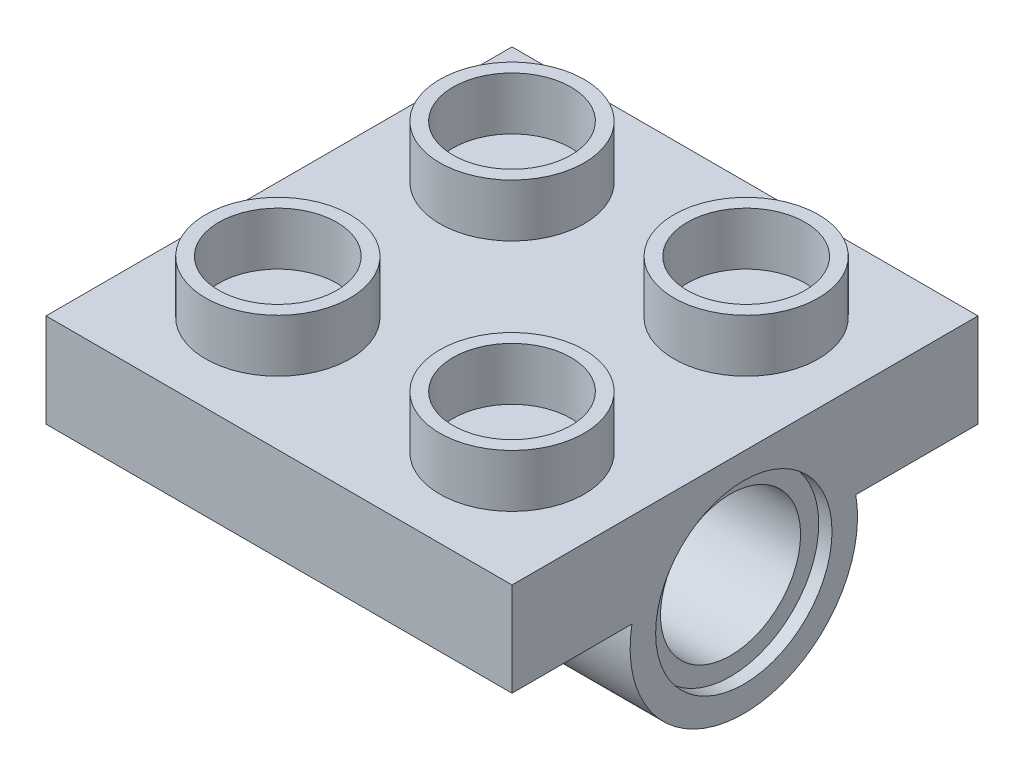
from build123d import *

# Parameters (mm, degrees)
SKETCH1_W               = 15.8
SKETCH1_H               = 15.8
BOSS_EXTRUDE1_DEPTH     = 7.71
SKETCH2_R               = 2.99
CUT_EXTRUDE1_DEPTH      = 0.45
SKETCH3_R               = 2.375
CUT_EXTRUDE2_DEPTH      = 6.56
CUT_EXTRUDE4_DEPTH      = 20.274182214
CUT_EXTRUDE4_DEPTH_BACK = 20.274182214
CUT_EXTRUDE5_DEPTH      = 20.274182214
CUT_EXTRUDE5_DEPTH_BACK = 8.87
CUT_EXTRUDE6_DEPTH      = 2.07
SKETCH10_W              = 5.44
SKETCH10_H              = 0.215050188
CUT_EXTRUDE8_DEPTH      = 2.07
SKETCH11_W              = 5.44
SKETCH11_H              = 0.461737218
CUT_EXTRUDE9_DEPTH      = 2.07
SKETCH12_W              = 4.93
SKETCH12_H              = 12.94
CUT_EXTRUDE10_DEPTH     = 2.07
SKETCH13_R              = 1.425
SKETCH13_R_2            = 1.1
BOSS_EXTRUDE2_DEPTH     = 1.87
SKETCH14_R              = 2.45
SKETCH14_R_2            = 2
BOSS_EXTRUDE3_DEPTH     = 1.79


with BuildPart() as part:
    # Sketch1 → Boss-Extrude1 (new body)
    with BuildSketch(Plane(origin=(0, 0, 0), x_dir=(1, 0, 0), z_dir=(0, 1, 0))):
        Rectangle(SKETCH1_W, SKETCH1_H)
    extrude(amount=-BOSS_EXTRUDE1_DEPTH)

    # Sketch2 → Cut-Extrude1 (cut)
    with BuildSketch(Plane(origin=(7.9, 0, 0), x_dir=(0, 0, -1), z_dir=(1, 0, 0))):
        with Locations((-0.04, -3.855)):
            Circle(SKETCH2_R)
    extrude(amount=-CUT_EXTRUDE1_DEPTH, mode=Mode.SUBTRACT)

    # Sketch3 → Cut-Extrude2 (cut)
    with BuildSketch(Plane(origin=(7.45, 0, 0), x_dir=(0, 0, -1), z_dir=(1, 0, 0))):
        with Locations((-0.04, -3.855)):
            Circle(SKETCH3_R)
    extrude(amount=-CUT_EXTRUDE2_DEPTH, mode=Mode.SUBTRACT)

    # Sketch4 → Cut-Extrude4 (cut, two sides: drawn at the far end of the back side and taken through both)
    with BuildSketch(Plane(origin=(7.9, 0, 0), x_dir=(0, 0, -1), z_dir=(1, 0, 0)).offset(-CUT_EXTRUDE4_DEPTH_BACK)):
        with BuildLine():
            Line((-50.773144054, -3.18), (-7.9, -3.18))
            Line((-7.9, -3.18), (-3.835444638, -3.18))
            ThreePointArc((-3.835444638, -3.18), (-0.04, -7.71), (3.755444638, -3.18))
            Line((3.755444638, -3.18), (7.9, -3.18))
            Line((7.9, -3.18), (50.773144054, -3.18))
            Line((50.773144054, -3.18), (50.773144054, -88.926288108))
            Line((50.773144054, -88.926288108), (-50.773144054, -88.926288108))
            Line((-50.773144054, -88.926288108), (-50.773144054, -3.18))
        make_face()
    extrude(amount=CUT_EXTRUDE4_DEPTH + CUT_EXTRUDE4_DEPTH_BACK, mode=Mode.SUBTRACT)

    # Sketch6 → Cut-Extrude5 (cut, two sides: drawn at the far end of the back side and taken through both)
    with BuildSketch(Plane.ZY.offset(7.9).offset(-CUT_EXTRUDE5_DEPTH_BACK)):
        Polygon((-38.914265028, -3.18), (-3.755444638, -3.18), (3.835444638, -3.18), (38.994265028, -3.18), (38.994265028, -73.49764078), (-38.914265028, -73.49764078), align=None)
    extrude(amount=CUT_EXTRUDE5_DEPTH + CUT_EXTRUDE5_DEPTH_BACK, mode=Mode.SUBTRACT)

    # Sketch7 → Cut-Extrude6 (cut)
    with BuildSketch(Plane.XZ.offset(3.18)):
        Polygon((6.41, 6.33), (-0.33, 6.33), (-0.33, -6.33), (6.41, -6.33), (6.41, -4.217181856), (0.97, -4.217181856), (0.97, 4.050494826), (6.41, 4.050494826), align=None)
    extrude(amount=-CUT_EXTRUDE6_DEPTH, mode=Mode.SUBTRACT)

    # Sketch10 → Cut-Extrude8 (cut)
    with BuildSketch(Plane.XZ.offset(3.18)):
        with Locations((3.69, 3.942969732)):
            Rectangle(SKETCH10_W, SKETCH10_H)
    extrude(amount=-CUT_EXTRUDE8_DEPTH, mode=Mode.SUBTRACT)

    # Sketch11 → Cut-Extrude9 (cut)
    with BuildSketch(Plane.XZ.offset(3.18)):
        with Locations((3.69, -3.986313247)):
            Rectangle(SKETCH11_W, SKETCH11_H)
    extrude(amount=-CUT_EXTRUDE9_DEPTH, mode=Mode.SUBTRACT)

    # Sketch12 → Cut-Extrude10 (cut)
    with BuildSketch(Plane.XZ.offset(3.18)):
        with Locations((-3.945, 0)):
            Rectangle(SKETCH12_W, SKETCH12_H)
    extrude(amount=-CUT_EXTRUDE10_DEPTH, mode=Mode.SUBTRACT)

    # Sketch13 → Boss-Extrude2 (add)
    with BuildSketch(Plane.XZ.offset(1.11)):
        with Locations(Location((-3.985, -0.04, 0), (0, 0, 90))):
            Circle(SKETCH13_R)
        with Locations(Location((-3.985, -0.04, 0), (0, 0, 90))):
            Circle(SKETCH13_R_2, mode=Mode.SUBTRACT)
    extrude(amount=BOSS_EXTRUDE2_DEPTH)

    # Sketch14 → Boss-Extrude3 (add)
    # profile 1 of 4: a face of its own
    with BuildSketch(Plane(origin=(0, 0, 0), x_dir=(1, 0, 0), z_dir=(0, 1, 0))):
        with Locations(Location((-3.93, 3.93, 0), (0, 0, 90))):
            Circle(SKETCH14_R)
        with Locations(Location((-3.93, 3.93, 0), (0, 0, 90))):
            Circle(SKETCH14_R_2, mode=Mode.SUBTRACT)
    # profile 2 of 4: a face of its own
    with BuildSketch(Plane(origin=(0, 0, 0), x_dir=(1, 0, 0), z_dir=(0, 1, 0))):
        with Locations(Location((4.01, 3.93, 0), (0, 0, 90))):
            Circle(SKETCH14_R)
        with Locations(Location((4.01, 3.93, 0), (0, 0, 90))):
            Circle(SKETCH14_R_2, mode=Mode.SUBTRACT)
    # profile 3 of 4: a face of its own
    with BuildSketch(Plane(origin=(0, 0, 0), x_dir=(1, 0, 0), z_dir=(0, 1, 0))):
        with Locations(Location((-3.93, -4.01, 0), (0, 0, 90))):
            Circle(SKETCH14_R)
        with Locations(Location((-3.93, -4.01, 0), (0, 0, 90))):
            Circle(SKETCH14_R_2, mode=Mode.SUBTRACT)
    # profile 4 of 4: a face of its own
    with BuildSketch(Plane(origin=(0, 0, 0), x_dir=(1, 0, 0), z_dir=(0, 1, 0))):
        with Locations(Location((4.01, -4.01, 0), (0, 0, 90))):
            Circle(SKETCH14_R)
        with Locations(Location((4.01, -4.01, 0), (0, 0, 90))):
            Circle(SKETCH14_R_2, mode=Mode.SUBTRACT)
    extrude(amount=BOSS_EXTRUDE3_DEPTH)


solid = part.part
